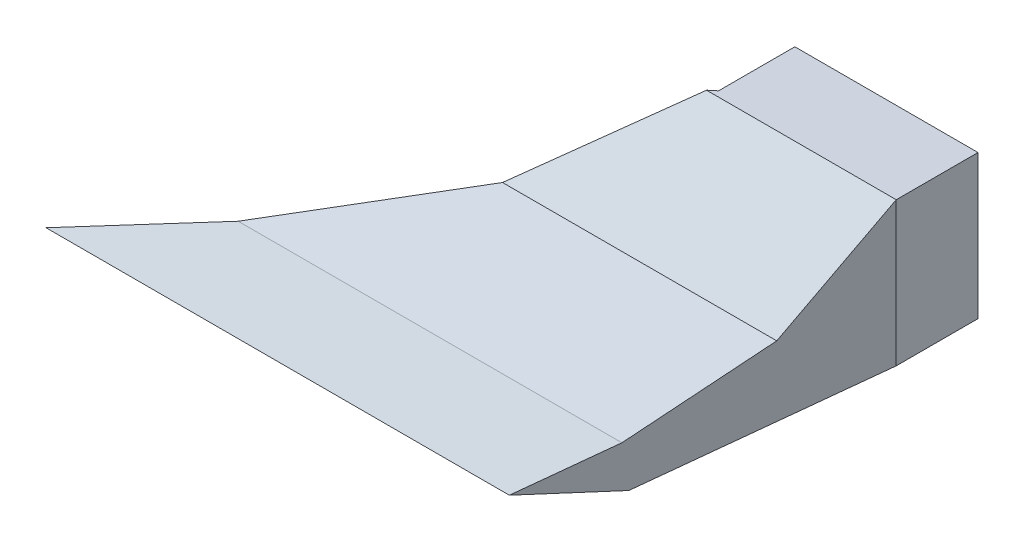
from build123d import *

# Parameters (mm, degrees)
SIDE_BASE_DEPTH                    = 0.5
SIDE_BASE_2_COUNT                  = 2
SIDE_BASE_2_PITCH                  = 50
FRONT_BACK_WALLS_REACH             = 60.566
BASE_SKETCH_W                      = 50.5
BASE_SKETCH_H                      = 13.2
BASE_SKETCH_W_2                    = 15.8
BASE_SKETCH_H_2                    = 11.998021326
BASE_DEPTH                         = 0.5
ATTACHMENT_BASE_SKETCH_W           = 16.8
ATTACHMENT_BASE_SKETCH_H           = 13.2
ATTACHMENT_BASE_SKETCH_W_2         = 15.8
ATTACHMENT_BASE_SKETCH_H_2         = 11.998021326
ATTACHMENT_BASE_DEPTH              = 7
PIPE_TOP_EXTRA_CUTAWAY_REACH       = 64.84
SKETCH11_W                         = 15.8
SKETCH11_H                         = 0.195081796
SKETCH1_W                          = 15.8
SKETCH1_H                          = 12.193103122
FAN_BASE_DEPTH                     = 0.1
LEFT_RIGHT_WALL_REMOVAL_DEPTH      = 59.566323483
LEFT_RIGHT_WALL_REMOVAL_DEPTH_BACK = 59.566323483
SKETCH6_W                          = 28.631700026
SKETCH6_H                          = 16.366666667
CUTAWAY_LEFT_DEPTH                 = 53.811785181
LEFT_WALL_DEPTH                    = 0.520740187
SKETCH9_W                          = 43.808738797
SKETCH9_H                          = 16.366666667
CUTAWAY_RIGHT_DEPTH                = 46.956653807
RIGHT_WALL_DEPTH                   = 0.781709206


with BuildPart() as part:
    # Side base sketch → Side base (new body)
    with BuildSketch(Plane.ZY):
        Polygon((0, 13.2), (8.491348573, 5), (19.491348573, 0.8030407), (27.491348573, -0.530292633), (19, -3.166666667), (6, -1), (0, 0), align=None)
    extrude(amount=-SIDE_BASE_DEPTH)


with BuildPart() as side_base_2_1:
    # Side base 2: pattern copy
    add(part.part.moved(Location(Vector(1, 0, 0) * (1 * SIDE_BASE_2_PITCH))))

    # Wall base sketch → Front back walls (add, up to next)
    with BuildSketch(Plane(origin=(0.5, 0, 0), x_dir=(0, 0, -1), z_dir=(1, 0, 0)), mode=Mode.PRIVATE) as front_back_walls_sk1:
        Polygon((0, 12.504918204), (-8.217574488, 4.569298766), (-19.359827502, 0.318064001), (-26.428993119, -0.860130268), (-27.491348573, -0.530292633), (-19.491348573, 0.8030407), (-8.491348573, 5), (0, 13.2), align=None)
    front_back_walls_tool1 = extrude(front_back_walls_sk1.sketch, amount=FRONT_BACK_WALLS_REACH, mode=Mode.PRIVATE) - side_base_2_1.part
    # Wall base sketch → Front back walls (add, up to next)
    with BuildSketch(Plane(origin=(0.5, 0, 0), x_dir=(0, 0, -1), z_dir=(1, 0, 0)), mode=Mode.PRIVATE) as front_back_walls_sk2:
        Polygon((0, 0.506896878), (-19, -2.659769789), (-19, -3.166666667), (0, 0), align=None)
    front_back_walls_tool2 = extrude(front_back_walls_sk2.sketch, amount=FRONT_BACK_WALLS_REACH, mode=Mode.PRIVATE) - side_base_2_1.part

    add(part.part)  # Front back walls merges part
    add(front_back_walls_tool1.solids().sort_by_distance((0.5, 8.759227, 4.323285))[0])
    add(front_back_walls_tool2.solids().sort_by_distance((0.5, -1.329885, 9.5))[0])

    # Base sketch → Base (add)
    with BuildSketch(Plane(origin=(0, 0, 0), x_dir=(-1, 0, 0), z_dir=(0, 0, -1))):
        with Locations((-25.25, 6.6)):
            Rectangle(BASE_SKETCH_W, BASE_SKETCH_H)
        with Locations((-42.1, 6.505907541)):
            Rectangle(BASE_SKETCH_W_2, BASE_SKETCH_H_2, mode=Mode.SUBTRACT)
    extrude(amount=BASE_DEPTH)

    # Attachment base sketch → Attachment base (add)
    with BuildSketch(Plane(origin=(0, 0, -0.5), x_dir=(-1, 0, 0), z_dir=(0, 0, -1))):
        with Locations((-42.1, 6.6)):
            Rectangle(ATTACHMENT_BASE_SKETCH_W, ATTACHMENT_BASE_SKETCH_H)
        with Locations((-42.1, 6.505907541)):
            Rectangle(ATTACHMENT_BASE_SKETCH_W_2, ATTACHMENT_BASE_SKETCH_H_2, mode=Mode.SUBTRACT)
    extrude(amount=ATTACHMENT_BASE_DEPTH)

    # Pipe top extra cutaway: up to this plane
    pipe_top_extra_cutaway_end = Plane(origin=(500000, 12.504918204, 0), z_dir=(0, 0.7193398003386524, 0.694658370458996))
    # Sketch11 → Pipe top extra cutaway (cut, up to the surface)
    with BuildSketch(Plane(origin=(0, 0, -7.5), x_dir=(-1, 0, 0), z_dir=(0, 0, -1)), mode=Mode.PRIVATE) as pipe_top_extra_cutaway_sk1:
        with Locations((-42.1, 12.602459102)):
            Rectangle(SKETCH11_W, SKETCH11_H)
    pipe_top_extra_cutaway_tool1 = split(extrude(pipe_top_extra_cutaway_sk1.sketch, amount=-PIPE_TOP_EXTRA_CUTAWAY_REACH, mode=Mode.PRIVATE), bisect_by=pipe_top_extra_cutaway_end, keep=Keep.BOTH, mode=Mode.PRIVATE)
    add(pipe_top_extra_cutaway_tool1.solids().sort_by_distance((42.1, 12.602459, -7.5))[0], mode=Mode.SUBTRACT)

    # Sketch4 → Left right wall removal (cut, two sides: drawn at the far end of the back side and taken through both)
    with BuildSketch(Plane(origin=(0.5, 0, 0), x_dir=(0, 0, -1), z_dir=(1, 0, 0)).offset(-LEFT_RIGHT_WALL_REMOVAL_DEPTH_BACK)):
        Polygon((-26.428993119, -0.860130268), (-19, -3.166666667), (-19, -2.659769789), (0, 0.506896878), (0, 12.504918204), (-8.217574488, 4.569298766), (-19.359827502, 0.318064001), align=None)
    extrude(amount=LEFT_RIGHT_WALL_REMOVAL_DEPTH + LEFT_RIGHT_WALL_REMOVAL_DEPTH_BACK, mode=Mode.SUBTRACT)

    # Sketch6 → Cutaway left (cut, through all)
    with BuildSketch(Plane(origin=(46.557451165, 0, 13.548248036), x_dir=(0.27941058312270783, 0, -0.9601717169543313), z_dir=(0.9601717169543312, 0, 0.2794105831227078))):
        with Locations((-0.205615565, 5.016666667)):
            Rectangle(SKETCH6_W, SKETCH6_H)
    extrude(amount=CUTAWAY_LEFT_DEPTH, mode=Mode.SUBTRACT)

    # Sketch7 → Left wall (add, along a direction that is not the sketch's normal)
    with BuildSketch(Plane(origin=(46.557451165, 0, 13.548248036), x_dir=(0.27941058312270806, 0, -0.9601717169543312), z_dir=(0.9601717169543312, 0, 0.27941058312270806))):
        Polygon((-5.67789268, -2.659769789), (-5.677892681, -3.166666667), (-13.415043221, -0.860130268), (-6.052645962, 0.318064001), (5.551791887, 4.569298766), (14.110234448, 12.504918204), (14.110234448, 0.506896878), align=None)
    extrude(amount=-LEFT_WALL_DEPTH, dir=(1, 0, 0))

    # Sketch9 → Cutaway right (cut, through all)
    with BuildSketch(Plane(origin=(13.512268511, 0, 16.268006796), x_dir=(0.7692529145051232, 0, -0.63894440566091), z_dir=(0.63894440566091, 0, 0.7692529145051232))):
        with Locations((4.338926024, 5.016666667)):
            Rectangle(SKETCH9_W, SKETCH9_H)
    extrude(amount=-CUTAWAY_RIGHT_DEPTH, mode=Mode.SUBTRACT)

    # Sketch10 → Right wall (add, along a direction that is not the sketch's normal)
    with BuildSketch(Plane(origin=(13.512268511, 0, 16.268006796), x_dir=(-0.7692529145051233, -2.5697854420108344e-15, 0.63894440566091), z_dir=(-0.6389444056609099, 0, -0.7692529145051232))):
        Polygon((-25.460754726, 12.504918204), (-25.460754725, 0.506896878), (4.275791728, -2.659769789), (4.275791728, -3.166666667), (15.902770622, -0.860130268), (4.838951055, 0.318064001), (-12.599581805, 4.569298766), align=None)
    extrude(amount=-RIGHT_WALL_DEPTH, dir=(-1, 0, 0))


with BuildPart() as body_2:
    # Sketch1 → Fan base (new body)
    with BuildSketch(Plane(origin=(0, 0, -7.5), x_dir=(-1, 0, 0), z_dir=(0, 0, -1))):
        with Locations((-42.1, 6.603448439)):
            Rectangle(SKETCH1_W, SKETCH1_H)
    extrude(amount=FAN_BASE_DEPTH)


solid = side_base_2_1.part
